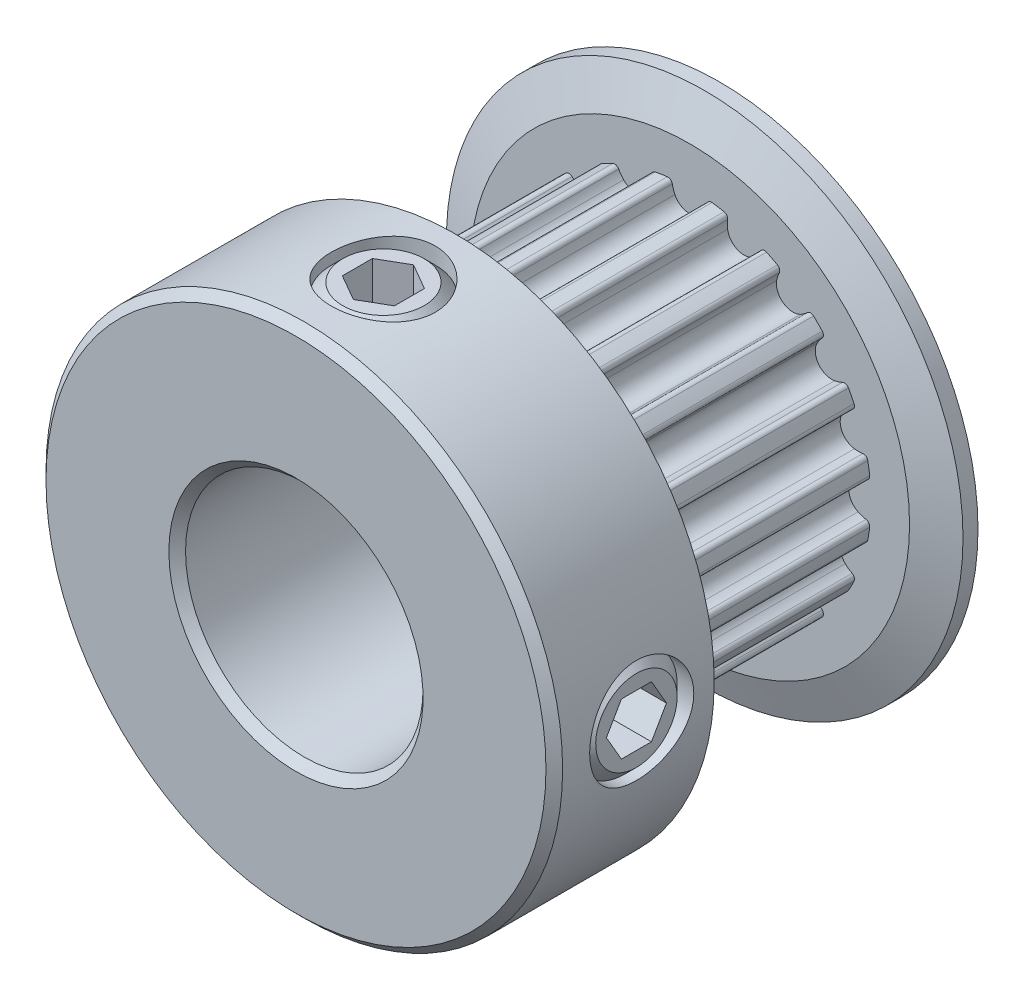
from build123d import *

# Parameters (mm, degrees)
CUT_EXTRUDE1_START = 1.245
CUT_EXTRUDE1_DEPTH = 7.37
CIRPATTERN1_COUNT  = 20
SKETCH4_R          = 1.7526
CUT_EXTRUDE2_DEPTH = 15.22219482
CUT_EXTRUDE3_DEPTH = 1.31445
CIRPATTERN3_COUNT  = 2
CIRPATTERN3_ANGLE  = 90
CHAMFER1_SIZE      = 0.28075


with BuildPart() as part:
    # Sketch2 → Revolve1 (revolve)
    with BuildSketch(Plane(origin=(0, 0, 0), x_dir=(0, 0, -1), z_dir=(1, 0, 0)), mode=Mode.PRIVATE) as revolve1_sk:
        Polygon((-7.135, 4), (7.135, 4), (7.135, 8.6995), (6.63, 8.6995), (6.125, 7.404), (6.125, 6.1085), (-1.245, 6.1085), (-1.245, 7.404), (-1.75, 8.6995), (-7.135, 8.6995), align=None)
    revolve(revolve1_sk.sketch.rotate(Axis((0, 0, 7.135), (0, 0, -1)), 90), axis=Axis((0, 0, 7.135), (0, 0, -1)))

    # Sketch3 → Cut-Extrude1 (cut)
    with BuildSketch(Plane.XY.offset(CUT_EXTRUDE1_START)):
        with BuildLine():
            Line((2.840989707, 8.6995), (-2.840989707, 8.6995))
            Line((-2.840989707, 8.6995), (-1.896292335, 5.806707124))
            ThreePointArc((-1.896292335, 5.806707124), (-1.330166224, 5.961914966), (-0.751756185, 6.062065233))
            ThreePointArc((-0.751756185, 6.062065233), (-0.643911332, 6.033664451), (-0.58547487, 5.93867868))
            ThreePointArc((-0.58547487, 5.93867868), (-0.551683777, 5.801420225), (-0.498876404, 5.670297753))
            ThreePointArc((-0.498876404, 5.670297753), (0, 5.3585), (0.498876404, 5.670297753))
            ThreePointArc((0.498876404, 5.670297753), (0.551683777, 5.801420225), (0.58547487, 5.93867868))
            ThreePointArc((0.58547487, 5.93867868), (0.643911332, 6.033664451), (0.751756185, 6.062065233))
            ThreePointArc((0.751756185, 6.062065233), (1.330166224, 5.961914966), (1.896292335, 5.806707124))
            Line((1.896292335, 5.806707124), (2.840989707, 8.6995))
        make_face()
    cut_extrude1 = extrude(amount=-CUT_EXTRUDE1_DEPTH, mode=Mode.SUBTRACT)

    # CirPattern1: Cut-Extrude1 ×20 about axis
    cirpattern1_axis = Axis((0, 0, 0), (0, 0, 1))
    for i in range(1, CIRPATTERN1_COUNT):
        add(cut_extrude1.rotate(cirpattern1_axis, i * 360 / CIRPATTERN1_COUNT), mode=Mode.SUBTRACT)

    # Sketch4 → Cut-Extrude2 (cut, through all)
    with BuildSketch(Plane(origin=(0, 0, 0), x_dir=(0, -1, 0), z_dir=(1, 0, 0))):
        with Locations(Location((0, -4.19, 0), (0, 0, 270))):
            Circle(SKETCH4_R)
    cut_extrude2 = extrude(amount=CUT_EXTRUDE2_DEPTH, mode=Mode.SUBTRACT)

    # Sketch5 → Revolve2 (revolve)
    with BuildSketch(Plane.XY.offset(4.19), mode=Mode.PRIVATE) as revolve2_sk:
        Polygon((4, -1.3716), (4, 0), (8.521132172, 0), (8.521132172, -1.3716), (8.140132172, -1.7526), (4.381, -1.7526), align=None)
    revolve2 = revolve(revolve2_sk.sketch.rotate(Axis((4, 0, 4.19), (1, 0, 0)), 270), axis=Axis((4, 0, 4.19), (1, 0, 0)))

    # Sketch6 → Cut-Extrude3 (cut)
    with BuildSketch(Plane(origin=(8.521132172, 5.384140679, 0), x_dir=(0, -1, 0), z_dir=(-1, 0, 0))):
        Polygon((5.384140679, 5.201864082), (4.507840679, 4.695932041), (4.507840679, 3.684067959), (5.384140679, 3.178135918), (6.260440679, 3.684067959), (6.260440679, 4.695932041), align=None)
    cut_extrude3 = extrude(amount=CUT_EXTRUDE3_DEPTH, mode=Mode.SUBTRACT)

    # CirPattern3: Cut-Extrude2, Revolve2, Cut-Extrude3 ×2 about axis
    cirpattern3_axis = Axis((0, 0, 0), (0, 0, 1))
    add([cut_extrude2.rotate(cirpattern3_axis, i * CIRPATTERN3_ANGLE / (CIRPATTERN3_COUNT - 1)) for i in range(1, CIRPATTERN3_COUNT)], mode=Mode.SUBTRACT)
    add([revolve2.rotate(cirpattern3_axis, i * CIRPATTERN3_ANGLE / (CIRPATTERN3_COUNT - 1)) for i in range(1, CIRPATTERN3_COUNT)])
    add([cut_extrude3.rotate(cirpattern3_axis, i * CIRPATTERN3_ANGLE / (CIRPATTERN3_COUNT - 1)) for i in range(1, CIRPATTERN3_COUNT)], mode=Mode.SUBTRACT)

    # Chamfer1
    chamfer1_edges = [part.edges().sort_by_distance(p)[0] for p in [
        (-4, 0, 7.135),
        (-8.6995, 0, 7.135),
    ]]
    chamfer(chamfer1_edges, length=CHAMFER1_SIZE)


solid = part.part
